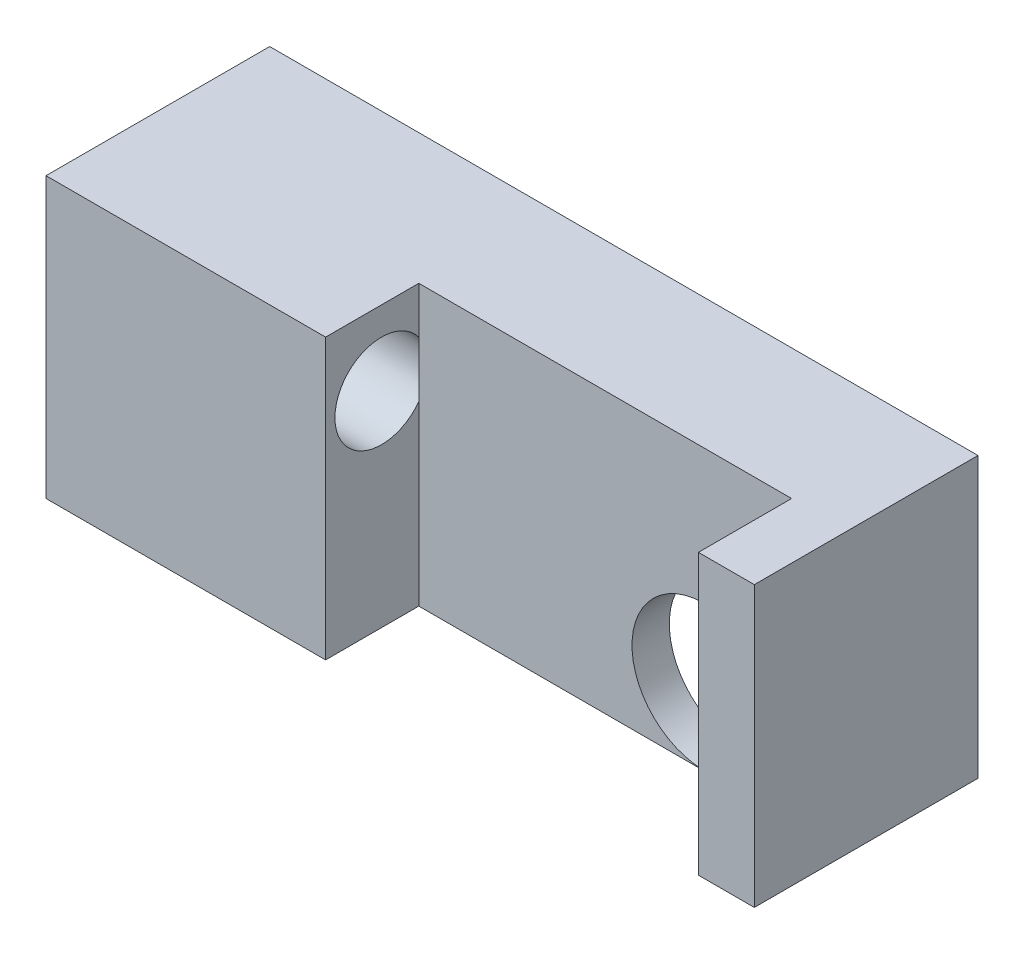
from build123d import *

# Parameters (mm, degrees)
SKETCH1_W           = 38
SKETCH1_H           = 12
BOSS_EXTRUDE1_DEPTH = 15
SKETCH2_R           = 1.15
CUT_EXTRUDE1_DEPTH  = 15
SKETCH3_W           = 20
SKETCH3_H           = 15
CUT_EXTRUDE2_DEPTH  = 5
CUT_EXTRUDE3_START  = -6
SKETCH2_3_R         = 2.5
CUT_EXTRUDE3_DEPTH  = 9
SKETCH4_W           = 23.485116632
SKETCH4_H           = 8.604460082
CUT_EXTRUDE4_DEPTH  = 5
SKETCH5_R           = 3.886662334
CUT_EXTRUDE5_DEPTH  = 2


with BuildPart() as part:
    # Sketch1 → Boss-Extrude1 (new body)
    with BuildSketch(Plane(origin=(0, 0, 0), x_dir=(1, 0, 0), z_dir=(0, 1, 0))):
        with Locations((19, 6)):
            Rectangle(SKETCH1_W, SKETCH1_H)
    extrude(amount=BOSS_EXTRUDE1_DEPTH)

    # Sketch2 → Cut-Extrude1 (cut)
    with BuildSketch(Plane.ZY):
        with Locations((-3, 11)):
            Circle(SKETCH2_R)
    extrude(amount=-CUT_EXTRUDE1_DEPTH, mode=Mode.SUBTRACT)

    # Sketch3 → Cut-Extrude2 (cut)
    with BuildSketch(Plane.XY):
        with Locations((25, 7.5)):
            Rectangle(SKETCH3_W, SKETCH3_H)
    extrude(amount=-CUT_EXTRUDE2_DEPTH, mode=Mode.SUBTRACT)

    # Sketch2<3> → Cut-Extrude3 (cut)
    with BuildSketch(Plane.ZY.offset(CUT_EXTRUDE3_START)):
        with Locations((-3, 11)):
            Circle(SKETCH2_3_R)
    extrude(amount=-CUT_EXTRUDE3_DEPTH, mode=Mode.SUBTRACT)

    # Sketch4 → Cut-Extrude4 (cut)
    with BuildSketch(Plane(origin=(0, 0, -12), x_dir=(-1, 0, 0), z_dir=(0, 0, -1))):
        with Locations((-21.50003141, 4.302230041)):
            Rectangle(SKETCH4_W, SKETCH4_H)
    extrude(amount=-CUT_EXTRUDE4_DEPTH, mode=Mode.SUBTRACT)

    # Sketch5 → Cut-Extrude5 (cut)
    with BuildSketch(Plane.XY.offset(-5)):
        with Locations((30.325082157, 3.904217079)):
            Circle(SKETCH5_R)
    extrude(amount=-CUT_EXTRUDE5_DEPTH, mode=Mode.SUBTRACT)


solid = part.part
